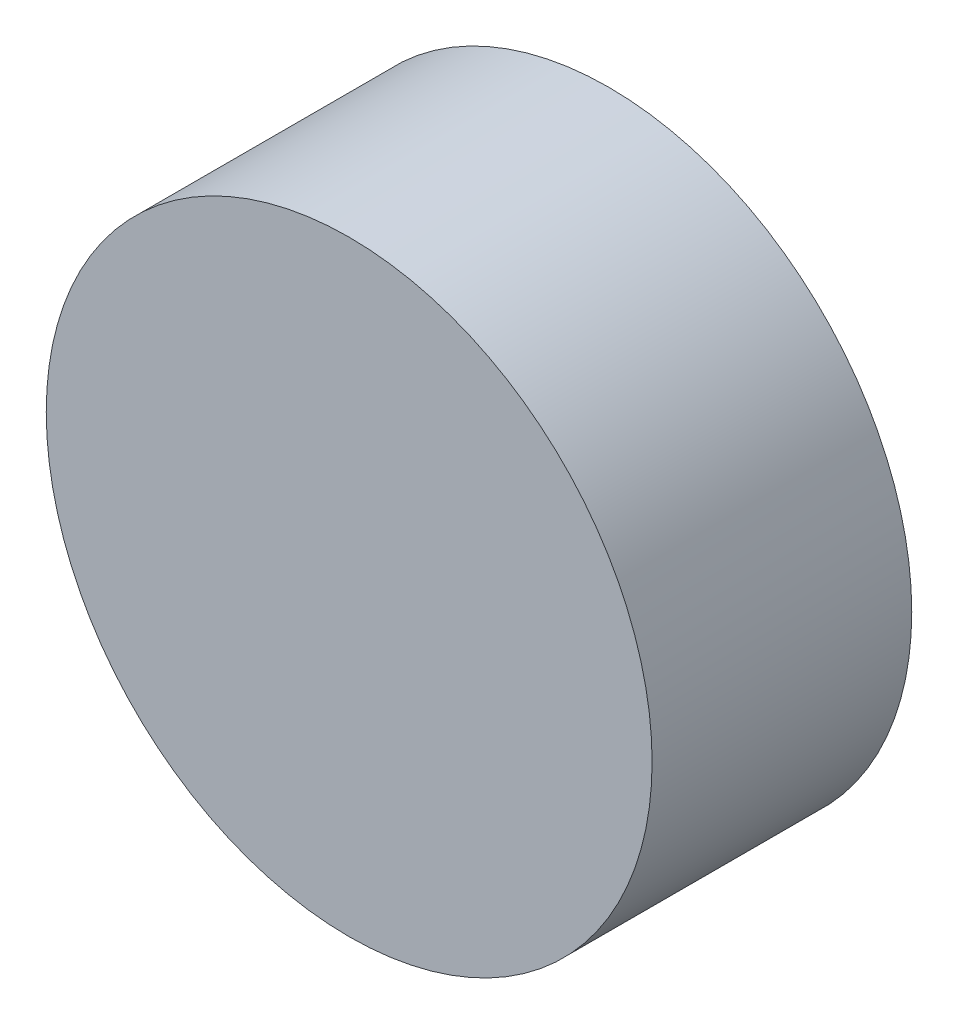
from build123d import *

# Parameters (mm, degrees)
SKETCH2_R           = 3.5
BOSS_EXTRUDE1_DEPTH = 3


with BuildPart() as part:
    # Sketch2 → Boss-Extrude1 (new body)
    with BuildSketch(Plane.XY):
        Circle(SKETCH2_R)
    extrude(amount=BOSS_EXTRUDE1_DEPTH)


solid = part.part
